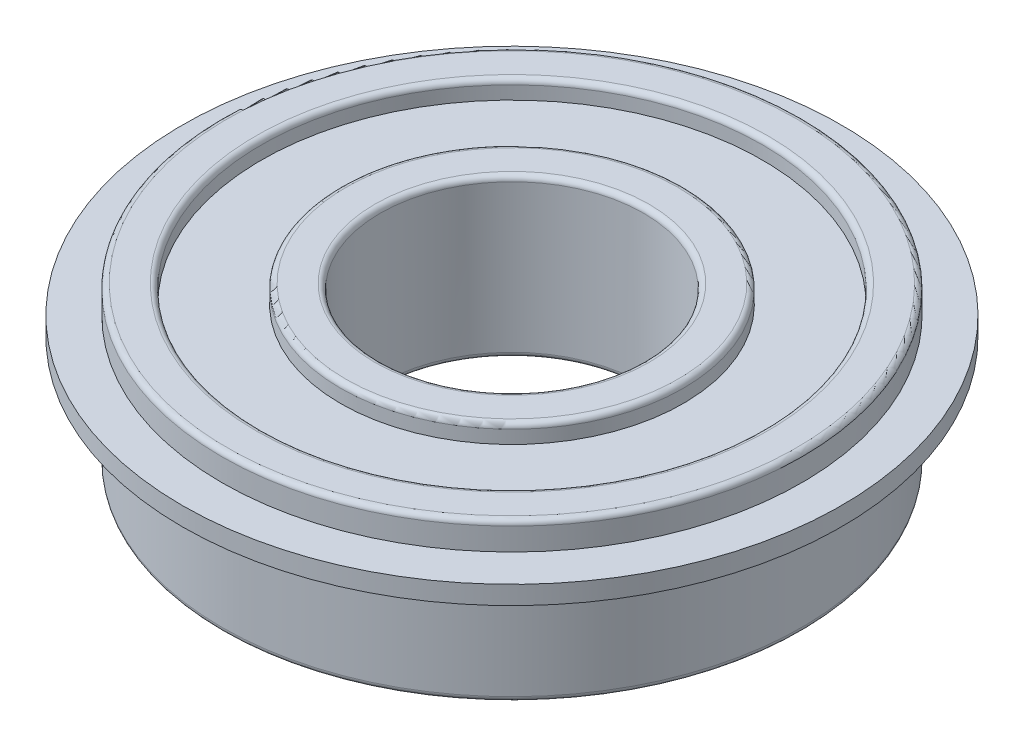
from build123d import *

# Parameters (mm, degrees)
FILLET_1_R      = 0.2
EXTRUDE_START   = -1.05
SKETCH_2_R      = 12.5
SKETCH_2_R_2    = 11
EXTRUDE_1_DEPTH = 0.7


with BuildPart() as part:
    # 草图1 → 旋转1 (revolve)
    with BuildSketch(Plane.XY, mode=Mode.PRIVATE) as revolve_1_sk:
        Polygon((5, 6), (5, 0), (6.5, 0), (6.5, 0.7), (9.5, 0.7), (9.5, 0), (11, 0), (11, 6), (9.5, 6), (9.5, 5.3), (6.5, 5.3), (6.5, 6), align=None)
    revolve(revolve_1_sk.sketch.rotate(Axis((0, 4.611296038, 0), (0, -1, 0)), 90), axis=Axis((0, 4.611296038, 0), (0, -1, 0)))

    # 圆角1
    fillet_1_edges = [part.edges().sort_by_distance(p)[0] for p in [
        (0, 6, -9.5),
        (0, 6, -11),
        (0, 0, -11),
        (0, 0, -9.5),
        (0, 0, -6.5),
        (0, 0, -5),
        (0, 6, -5),
        (0, 6, -6.5),
    ]]
    fillet(fillet_1_edges, radius=FILLET_1_R)

    # 草图2 → 凸台-拉伸1 (add)
    with BuildSketch(Plane(origin=(0, 6, 0), x_dir=(1, 0, 0), z_dir=(0, 1, 0)).offset(EXTRUDE_START)):
        with Locations(Location((0, 0, 0), (0, 0, 270))):
            Circle(SKETCH_2_R)
        with Locations(Location((0, 0, 0), (0, 0, 270))):
            Circle(SKETCH_2_R_2, mode=Mode.SUBTRACT)
    extrude(amount=-EXTRUDE_1_DEPTH)


solid = part.part
